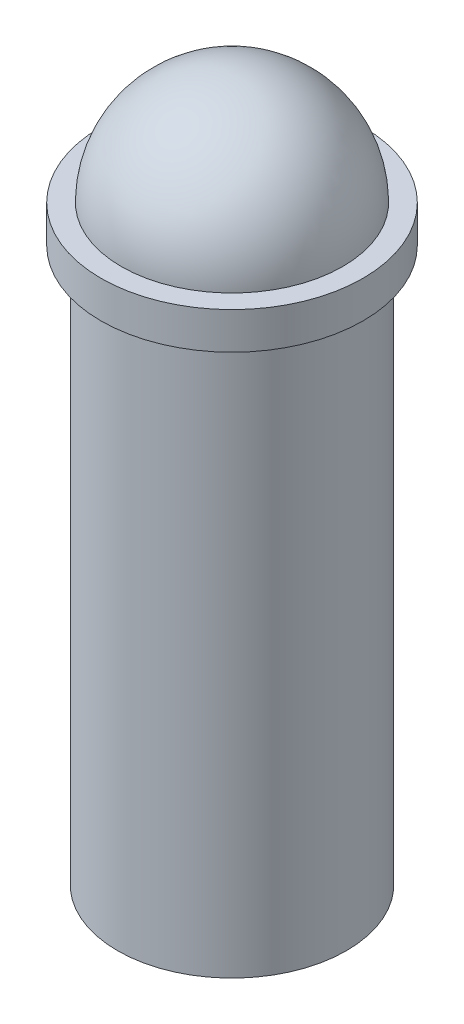
from build123d import *

# Parameters (mm, degrees)
SKETCH1_R           = 3.55
BOSS_EXTRUDE1_DEPTH = 1
SKETCH3_R           = 3.1
BOSS_EXTRUDE2_DEPTH = 15


with BuildPart() as part:
    # Sketch1 → Boss-Extrude1 (new body)
    with BuildSketch(Plane(origin=(0, 0, 0), x_dir=(1, 0, 0), z_dir=(0, 1, 0))):
        Circle(SKETCH1_R)
    extrude(amount=BOSS_EXTRUDE1_DEPTH)

    # Sketch2 → Revolve1 (revolve)
    with BuildSketch(Plane(origin=(0, 0, 0), x_dir=(0, 0, -1), z_dir=(1, 0, 0))):
        with BuildLine():
            Line((0, 1), (0, 4))
            ThreePointArc((0, 4), (2.121320344, 3.121320344), (3, 1))
            Line((3, 1), (0, 1))
        make_face()
    revolve(axis=Axis((0, 1, 0), (0, -1, 0)))

    # Sketch3 → Boss-Extrude2 (add)
    with BuildSketch(Plane.XZ):
        Circle(SKETCH3_R)
    extrude(amount=BOSS_EXTRUDE2_DEPTH)


solid = part.part
